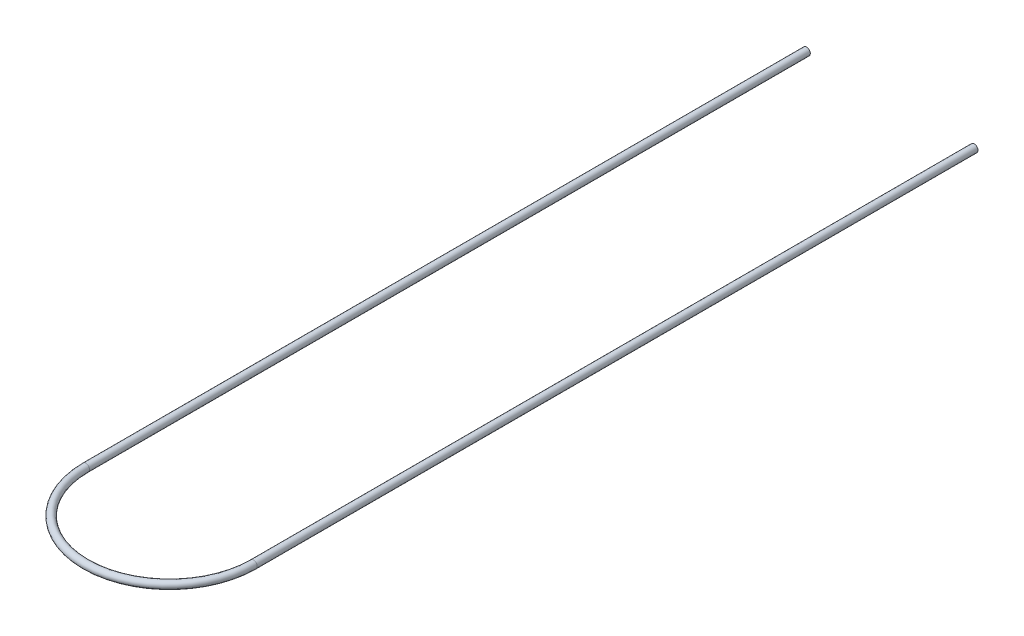
from build123d import *

# Parameters (mm, degrees)
SKETCH2_R   = 11.1
SKETCH2_R_2 = 9.95


with BuildPart() as part:
    # Sweep1: sweep along a path in Sketch1
    with BuildLine(Plane(origin=(0, 0, 0), x_dir=(1, 0, 0), z_dir=(0, 1, 0))) as sweep1_path:
        Line((457.85, -300), (457.85, -2440))
        ThreePointArc((457.85, -2440), (208.925, -2688.925), (-40, -2440))
        Line((-40, -2440), (-40, -300))
    # Sketch2 → Sweep1 (sweep)
    with BuildSketch(Plane(origin=(457.85, 0, 300), x_dir=(-1, 0, 0), z_dir=(0, 0, -1))):
        Circle(SKETCH2_R)
        Circle(SKETCH2_R_2, mode=Mode.SUBTRACT)
    sweep(path=sweep1_path.line)


solid = part.part
